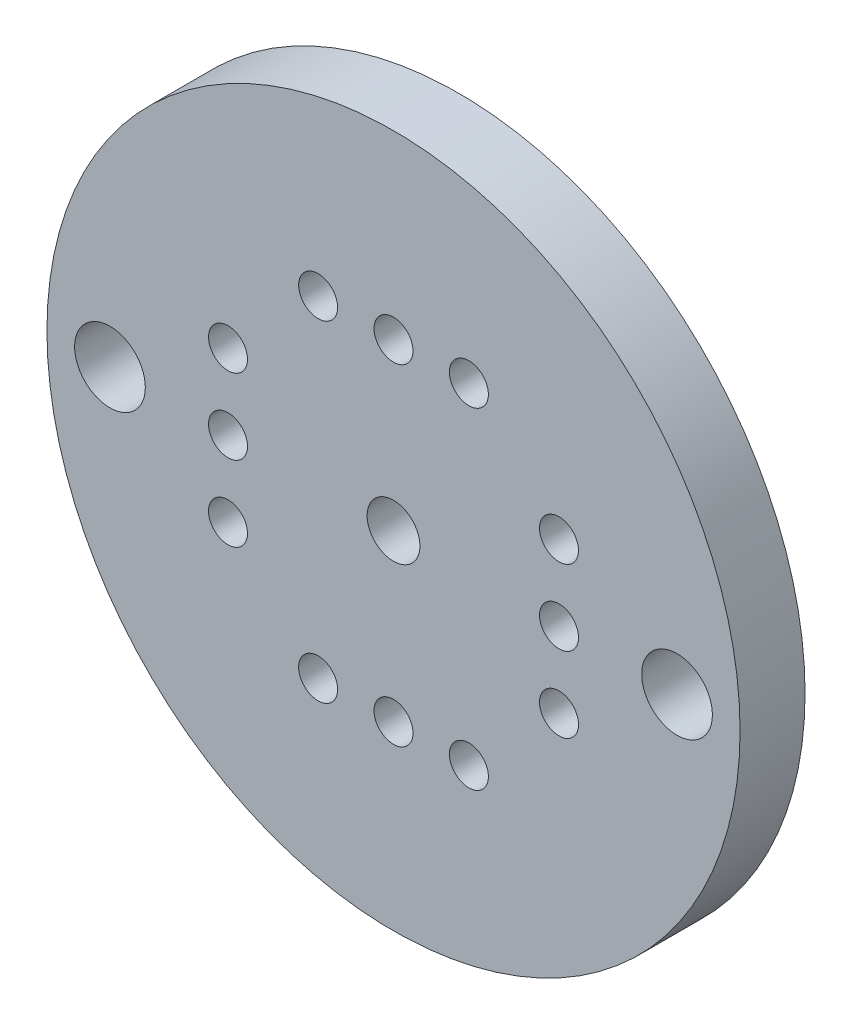
from build123d import *

# Parameters (mm, degrees)
SKETCH1_R              = 16
BOSS_EXTRUDE1_DEPTH    = 3
M1_6_CLEARANCE_HOLE1_D = 1.8
F_4_CLEARANCE_HOLE1_D  = 3.2639
F_2_CLEARANCE_HOLE1_D  = 2.4384


with BuildPart() as part:
    # Sketch1 → Boss-Extrude1 (new body)
    with BuildSketch(Plane.XY):
        Circle(SKETCH1_R)
    extrude(amount=BOSS_EXTRUDE1_DEPTH)

    # M1.6 Clearance Hole1 (through all)
    with Locations(Plane.XY.offset(3)):
        with Locations((-3.48, 7.64), (0, 7.64), (3.48, 7.64), (7.64, 3.48), (7.64, -3.48), (7.64, 0), (3.48, -7.64), (0, -7.64), (-3.48, -7.64), (-7.64, 0), (-7.64, -3.48), (-7.64, 3.48)):
            Hole(M1_6_CLEARANCE_HOLE1_D / 2)

    # #4 Clearance Hole1 (through all)
    with Locations(Plane.XY.offset(3)):
        with Locations((-13.09, 0), (13.09, 0)):
            Hole(F_4_CLEARANCE_HOLE1_D / 2)

    # #2 Clearance Hole1 (through all)
    with Locations(Plane.XY.offset(3)):
        with Locations((0, 0)):
            Hole(F_2_CLEARANCE_HOLE1_D / 2)


solid = part.part
